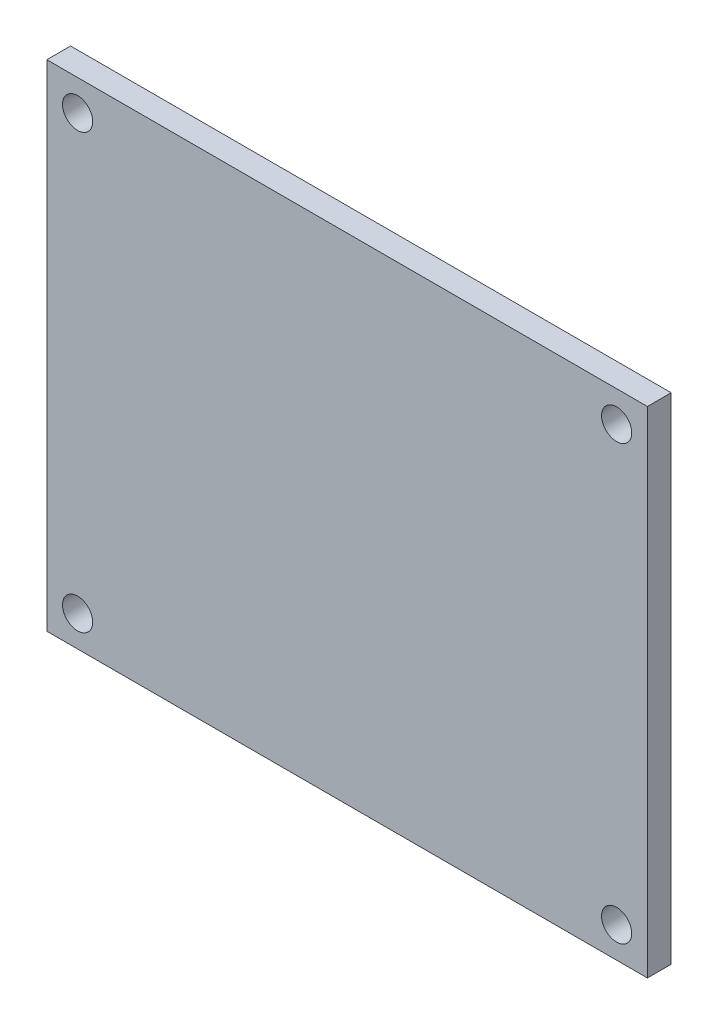
from build123d import *

# Parameters (mm, degrees)
SKETCH1_W           = 46.55
SKETCH1_H           = 2
BOSS_EXTRUDE1_DEPTH = 2
SKETCH11_W          = 46.55
SKETCH11_H          = 37.66
BOSS_EXTRUDE3_DEPTH = 2
SKETCH12_R          = 1.27
CUT_EXTRUDE6_DEPTH  = 2


with BuildPart() as part:
    # Sketch1 → Boss-Extrude1 (new body)
    with BuildSketch(Plane.XY):
        with Locations((-25.275, 40.66)):
            Rectangle(SKETCH1_W, SKETCH1_H)
        Polygon((-2, 0), (0, 0), (0, 41.66), (-2, 41.66), (-2, 39.66), (-2, 2), align=None)
        Polygon((-50.55, 0), (-48.55, 0), (-48.55, 2), (-48.55, 39.66), (-48.55, 41.66), (-50.55, 41.66), align=None)
        with Locations((-25.275, 1)):
            Rectangle(SKETCH1_W, SKETCH1_H)
    extrude(amount=BOSS_EXTRUDE1_DEPTH)

    # Sketch11 → Boss-Extrude3 (add)
    with BuildSketch(Plane(origin=(0, 0, 0), x_dir=(-1, 0, 0), z_dir=(0, 0, -1))):
        with Locations((25.275, 20.83)):
            Rectangle(SKETCH11_W, SKETCH11_H)
    extrude(amount=-BOSS_EXTRUDE3_DEPTH)

    # Sketch12 → Cut-Extrude6 (cut)
    with BuildSketch(Plane(origin=(0, 0, 0), x_dir=(-1, 0, 0), z_dir=(0, 0, -1))):
        with Locations((2.59, 39.07)):
            Circle(SKETCH12_R)
        with Locations((47.96, 39.07)):
            Circle(SKETCH12_R)
        with Locations((2.59, 2.59)):
            Circle(SKETCH12_R)
        with Locations((47.96, 2.59)):
            Circle(SKETCH12_R)
    extrude(amount=-CUT_EXTRUDE6_DEPTH, mode=Mode.SUBTRACT)


solid = part.part
